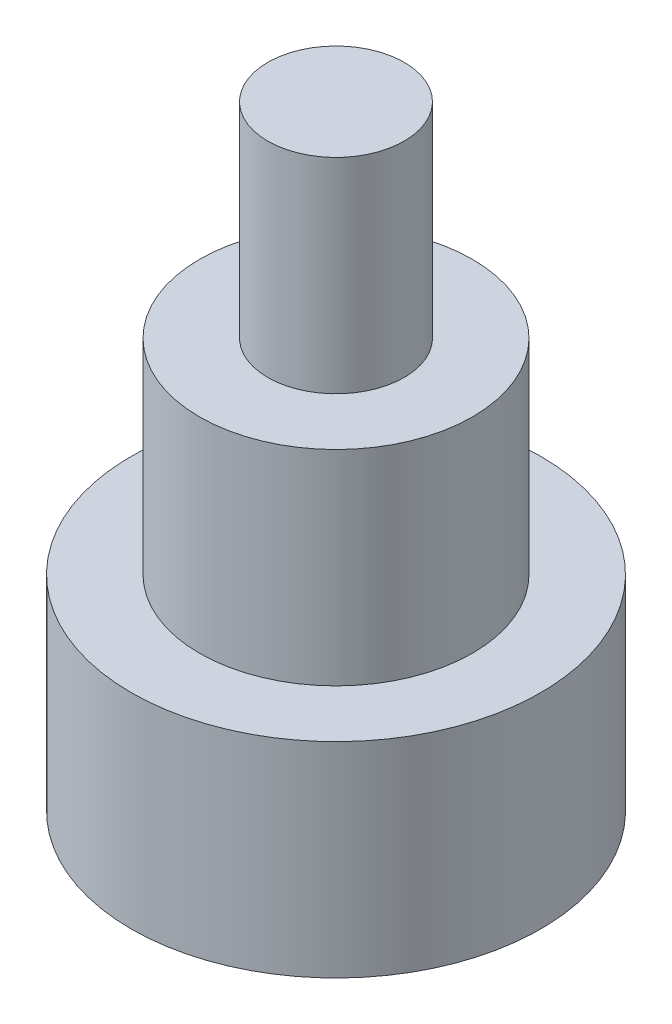
from build123d import *

# Parameters (mm, degrees)
SKETCH_1_R      = 30
EXTRUDE_1_DEPTH = 30
SKETCH_2_R      = 20
EXTRUDE_2_DEPTH = 30
SKETCH_3_R      = 10
EXTRUDE_3_DEPTH = 30


with BuildPart() as part:
    # 스케치1 → 보스-돌출1 (new body)
    with BuildSketch(Plane(origin=(0, 0, 0), x_dir=(1, 0, 0), z_dir=(0, 1, 0))):
        with Locations(Location((-14.094851134, 0.923455764, 0), (0, 0, 270))):
            Circle(SKETCH_1_R)
    extrude(amount=EXTRUDE_1_DEPTH)

    # 스케치2 → 보스-돌출2 (add)
    with BuildSketch(Plane(origin=(0, 30, 0), x_dir=(1, 0, 0), z_dir=(0, 1, 0))):
        with Locations(Location((-14.094851134, 0.923455764, 0), (0, 0, 270))):
            Circle(SKETCH_2_R)
    extrude(amount=EXTRUDE_2_DEPTH)

    # 스케치3 → 보스-돌출3 (add)
    with BuildSketch(Plane(origin=(0, 60, 0), x_dir=(1, 0, 0), z_dir=(0, 1, 0))):
        with Locations(Location((-14.094851134, 0.923455764, 0), (0, 0, 270))):
            Circle(SKETCH_3_R)
    extrude(amount=EXTRUDE_3_DEPTH)


solid = part.part
